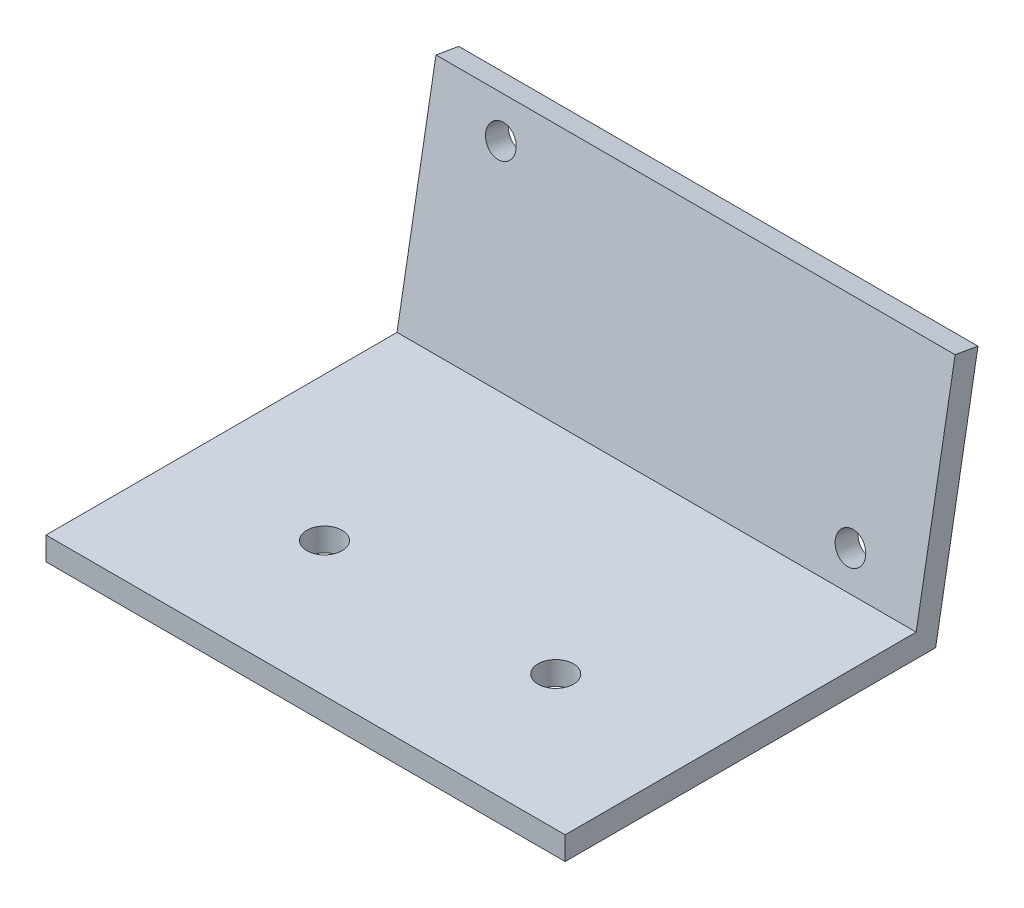
from build123d import *

# Parameters (mm, degrees)
BOSS_EXTRUDE1_DEPTH = 55.88
SKETCH4_R           = 1.905
CUT_EXTRUDE1_DEPTH  = 42.418
SKETCH5_R           = 1.6256
CUT_EXTRUDE2_DEPTH  = 2.5


with BuildPart() as part:
    # Sketch3 → Boss-Extrude1 (new body)
    with BuildSketch(Plane(origin=(0, 0, 0), x_dir=(0, 0, -1), z_dir=(1, 0, 0))):
        Polygon((-72.719013739, -0.661158353), (-72.719013739, 1.838841647), (-34.938762817, 1.838841647), (-30.74863229, 25.602252727), (-28.286612908, 25.168132283), (-32.841013739, -0.661158353), align=None)
    extrude(amount=-BOSS_EXTRUDE1_DEPTH)

    # Sketch4 → Cut-Extrude1 (cut)
    with BuildSketch(Plane(origin=(0, 1.838841647, 0), x_dir=(1, 0, 0), z_dir=(0, 1, 0))):
        with Locations(Location((-40.386, -58.241013739, 0), (0, 0, 270))):
            Circle(SKETCH4_R)
        with Locations(Location((-15.494, -58.241013739, 0), (0, 0, 270))):
            Circle(SKETCH4_R)
    extrude(amount=-CUT_EXTRUDE1_DEPTH, mode=Mode.SUBTRACT)

    # Sketch5 → Cut-Extrude2 (cut)
    with BuildSketch(Plane(origin=(0, 5.596207749, 31.737671267), x_dir=(-1, 0, 0), z_dir=(0, -0.17364817766692642, -0.9848077530122088))):
        with Locations(Location((48.214905279, 15.963281142, 0), (0, 0, 90))):
            Circle(SKETCH5_R)
        with Locations(Location((7.7216, -0.546718858, 0), (0, 0, 90))):
            Circle(SKETCH5_R)
    extrude(amount=-CUT_EXTRUDE2_DEPTH, mode=Mode.SUBTRACT)


solid = part.part
